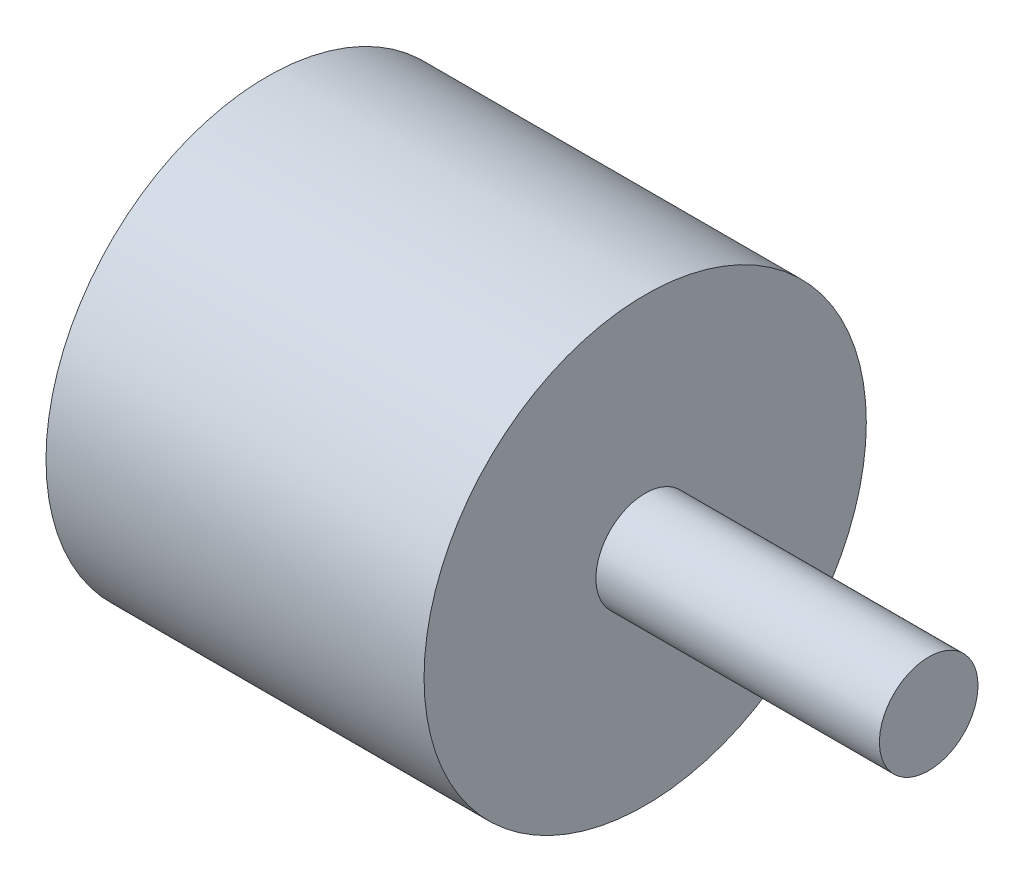
from build123d import *

# Parameters (mm, degrees)
SKETCH1_R           = 23.397143916
BOSS_EXTRUDE1_DEPTH = 40
SKETCH2_R           = 5.21429466
BOSS_EXTRUDE2_DEPTH = 30


with BuildPart() as part:
    # Sketch1 → Boss-Extrude1 (new body)
    with BuildSketch(Plane(origin=(0, 0, 0), x_dir=(0, 0, -1), z_dir=(1, 0, 0))):
        Circle(SKETCH1_R)
    extrude(amount=BOSS_EXTRUDE1_DEPTH)

    # Sketch2 → Boss-Extrude2 (add)
    with BuildSketch(Plane(origin=(40, 0, 0), x_dir=(0, 0, -1), z_dir=(1, 0, 0))):
        Circle(SKETCH2_R)
    extrude(amount=BOSS_EXTRUDE2_DEPTH)


solid = part.part
